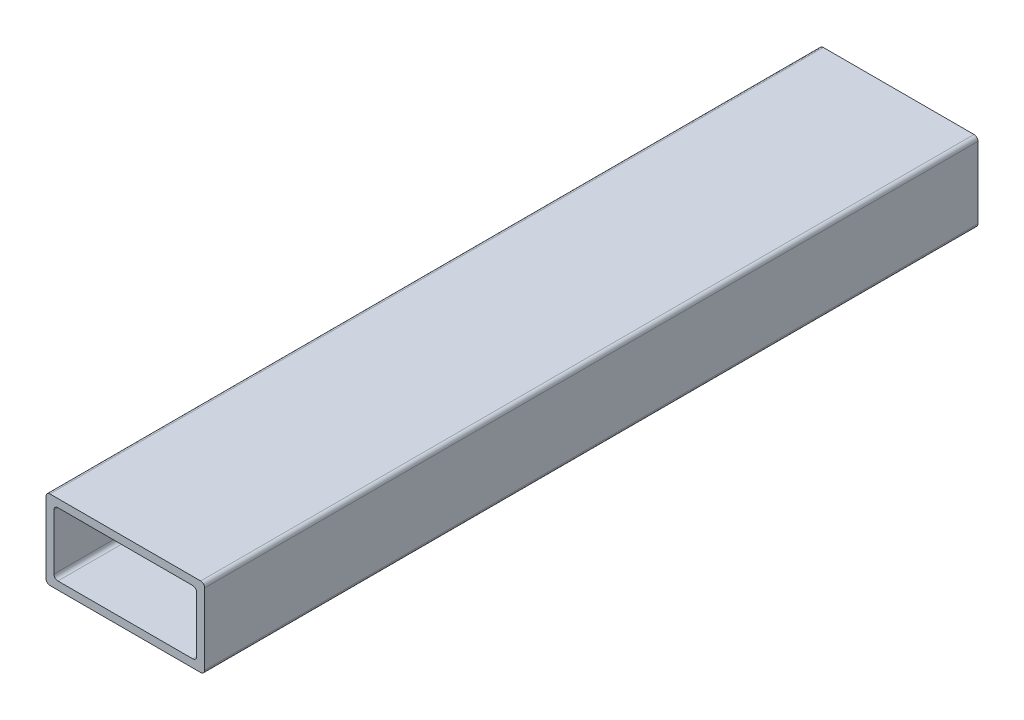
from build123d import *

# Parameters (mm, degrees)
BOSS_EXTRU_1_DEPTH = 390


with BuildPart() as part:
    # Esquisse2 → Boss.-Extru.1 (new body)
    with BuildSketch(Plane.XY):
        with BuildLine():
            Line((2, 0), (78, 0))
            ThreePointArc((78, 0), (79.414213562, 0.585786438), (80, 2))
            Line((80, 2), (80, 38))
            ThreePointArc((80, 38), (79.414213562, 39.414213562), (78, 40))
            Line((78, 40), (2, 40))
            ThreePointArc((2, 40), (0.585786438, 39.414213562), (0, 38))
            Line((0, 38), (0, 2))
            ThreePointArc((0, 2), (0.585786438, 0.585786438), (2, 0))
        make_face()
        with BuildLine():
            Line((6, 4), (74, 4))
            ThreePointArc((74, 4), (75.414213562, 4.585786438), (76, 6))
            Line((76, 6), (76, 34))
            ThreePointArc((76, 34), (75.414213562, 35.414213562), (74, 36))
            Line((74, 36), (6, 36))
            ThreePointArc((6, 36), (4.585786438, 35.414213562), (4, 34))
            Line((4, 34), (4, 6))
            ThreePointArc((4, 6), (4.585786438, 4.585786438), (6, 4))
        make_face(mode=Mode.SUBTRACT)
    extrude(amount=BOSS_EXTRU_1_DEPTH)


solid = part.part
